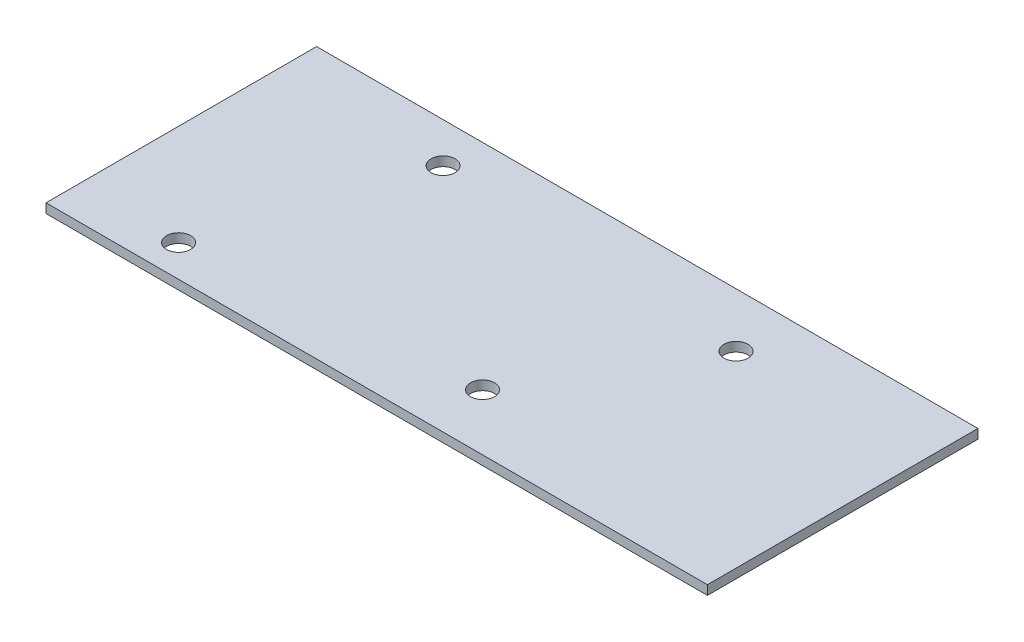
from build123d import *

# Parameters (mm, degrees)
ESQUISSE1_W             = 110
ESQUISSE1_H             = 45
BOSS_EXTRU_1_DEPTH      = 1.55
ESQUISSE2_R             = 2
ENL_V_MAT_EXTRU_1_DEPTH = 3


with BuildPart() as part:
    # Esquisse1 → Boss.-Extru.1 (new body)
    with BuildSketch(Plane(origin=(0, 0, 0), x_dir=(1, 0, 0), z_dir=(0, 1, 0))):
        Rectangle(ESQUISSE1_W, ESQUISSE1_H)
    extrude(amount=BOSS_EXTRU_1_DEPTH)

    # Esquisse2 → Enlèv. mat.-Extru.1 (cut)
    with BuildSketch(Plane(origin=(0, 1.55, 0), x_dir=(1, 0, 0), z_dir=(0, 1, 0))):
        with Locations(Location((-38.25, -17.2, 0), (0, 0, 270))):
            Circle(ESQUISSE2_R)
        with Locations(Location((-27.32, 15.86, 0), (0, 0, 270))):
            Circle(ESQUISSE2_R)
        with Locations(Location((23.75, 13.5, 0), (0, 0, 270))):
            Circle(ESQUISSE2_R)
        with Locations(Location((8.23, -13.12, 0), (0, 0, 270))):
            Circle(ESQUISSE2_R)
    extrude(amount=-ENL_V_MAT_EXTRU_1_DEPTH, mode=Mode.SUBTRACT)


solid = part.part
